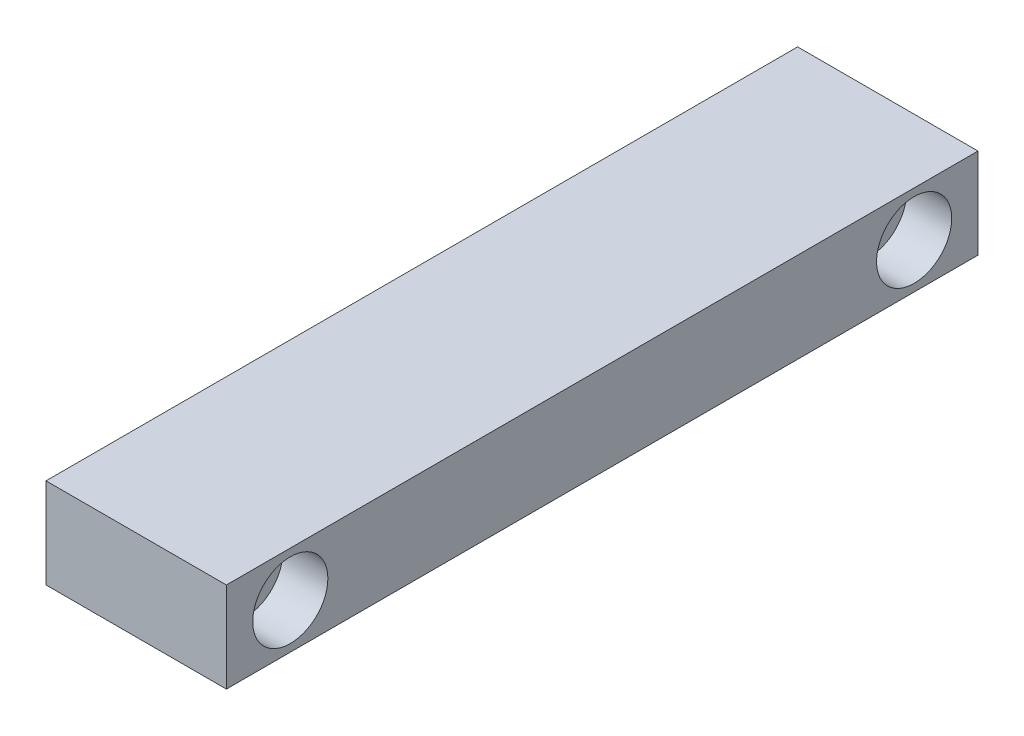
from build123d import *

# Parameters (mm, degrees)
ESQUISSE1_W             = 48
ESQUISSE1_H             = 200
BOSS_EXTRU_1_DEPTH      = 24
ESQUISSE2_R             = 4
ENL_V_MAT_EXTRU_1_DEPTH = 114.490087673
ESQUISSE3_R             = 10
ENL_V_MAT_EXTRU_2_DEPTH = 12
ESQUISSE4_R             = 7
ENL_V_MAT_EXTRU_3_DEPTH = 12


with BuildPart() as part:
    # Esquisse1 → Boss.-Extru.1 (new body)
    with BuildSketch(Plane(origin=(0, 0, 0), x_dir=(1, 0, 0), z_dir=(0, 1, 0))):
        Rectangle(ESQUISSE1_W, ESQUISSE1_H)
    extrude(amount=BOSS_EXTRU_1_DEPTH)

    # Esquisse2 → Enlèv. mat.-Extru.1 (cut, through all)
    with BuildSketch(Plane(origin=(24, 0, 0), x_dir=(0, 0, -1), z_dir=(1, 0, 0))):
        with Locations((-83, 12)):
            Circle(ESQUISSE2_R)
        with Locations((83, 12)):
            Circle(ESQUISSE2_R)
    extrude(amount=-ENL_V_MAT_EXTRU_1_DEPTH, mode=Mode.SUBTRACT)

    # Esquisse3 → Enlèv. mat.-Extru.2 (cut)
    with BuildSketch(Plane(origin=(24, 0, 0), x_dir=(0, 0, -1), z_dir=(1, 0, 0))):
        with Locations((-83, 12)):
            Circle(ESQUISSE3_R)
        with Locations((83, 12)):
            Circle(ESQUISSE3_R)
    extrude(amount=-ENL_V_MAT_EXTRU_2_DEPTH, mode=Mode.SUBTRACT)

    # Esquisse4 → Enlèv. mat.-Extru.3 (cut)
    with BuildSketch(Plane.ZY.offset(24)):
        with Locations((-83, 12)):
            Circle(ESQUISSE4_R)
        with Locations((83, 12)):
            Circle(ESQUISSE4_R)
    extrude(amount=-ENL_V_MAT_EXTRU_3_DEPTH, mode=Mode.SUBTRACT)


solid = part.part
